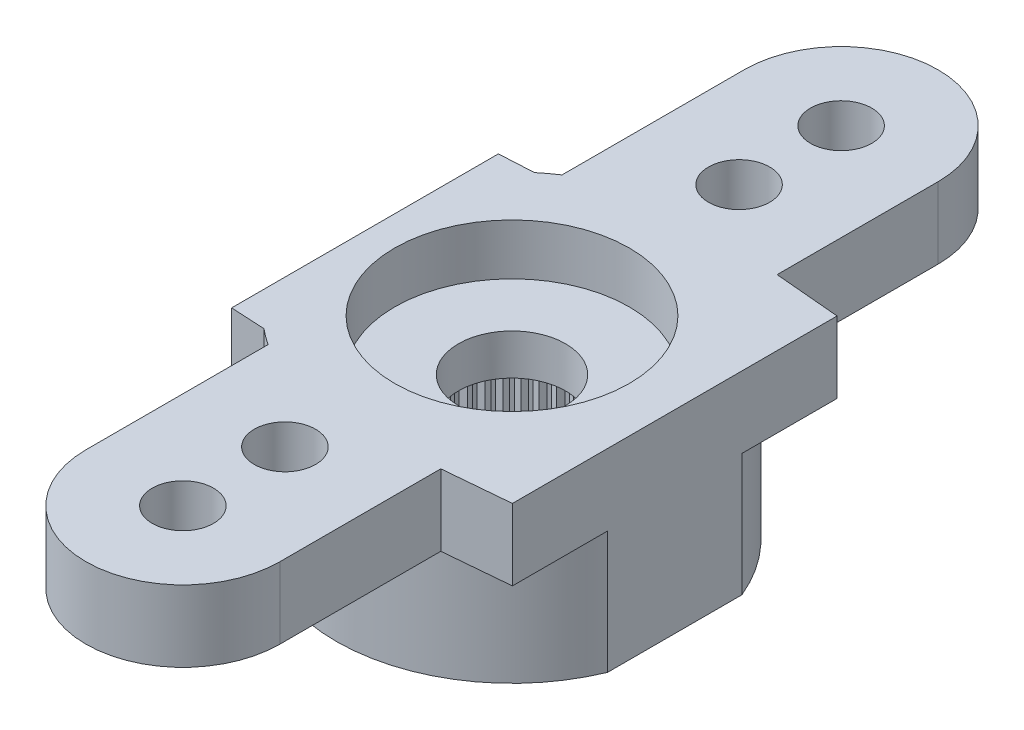
from build123d import *

# Parameters (mm, degrees)
RESSALTO_EXTRUS_O1_DEPTH = 1.4
ESBO_O2_R                = 3.45
RESSALTO_EXTRUS_O2_DEPTH = 2.4
FURO1_D                  = 1.2
PADR_O_LINEAR1_COUNT     = 6
PADR_O_LINEAR1_PITCH     = 2
RESSALTO_EXTRUS_O3_DEPTH = 1.4
FURO2_D                  = 1.2
PADR_O_LINEAR2_COUNT     = 7
PADR_O_LINEAR2_PITCH     = 2
RESSALTO_EXTRUS_O4_DEPTH = 1.4
FURO3_D                  = 1.2
PADR_O_LINEAR3_COUNT     = 2
PADR_O_LINEAR3_PITCH     = 2
PADR_OCIRCULAR1_COUNT    = 2
PADR_OCIRCULAR1_COPY_1_D = 1.2
FURO4_D                  = 4.95
FURO4_DEPTH              = 2
FURO5_D                  = 4.6
FURO5_DEPTH              = 1
FURO6_D                  = 2.1
RESSALTO_EXTRUS_O5_START = -2
RESSALTO_EXTRUS_O5_DEPTH = 2
PADR_OCIRCULAR2_COUNT    = 60
SKETCH4_W                = 15.495114936
SKETCH4_H                = 17.003754514
SKETCH4_W_2              = 16.940618464
SKETCH4_H_2              = 16.09212465
CUT_EXTRUDE1_DEPTH       = 10


with BuildPart() as part:
    # Esboço1 → Ressalto-extrusão1 (new body)
    with BuildSketch(Plane(origin=(0, 0, 0), x_dir=(1, 0, 0), z_dir=(0, 1, 0))):
        with BuildLine():
            Line((-14.159121967, 1.99702088), (-2.209072203, 2.65))
            ThreePointArc((-2.209072203, 2.65), (3.45, 0), (-2.209072203, -2.65))
            Line((-2.209072203, -2.65), (-14.159121967, -1.99702088))
            ThreePointArc((-14.159121967, -1.99702088), (-16.05, 0), (-14.159121967, 1.99702088))
        make_face()
    extrude(amount=-RESSALTO_EXTRUS_O1_DEPTH)

    # Esboço2 → Ressalto-extrusão2 (add)
    with BuildSketch(Plane.XZ.offset(1.4)):
        with Locations(Location((0, 0, 0), (0, 0, 90))):
            Circle(ESBO_O2_R)
    extrude(amount=RESSALTO_EXTRUS_O2_DEPTH)

    # Furo1 (through all)
    with Locations(Plane(origin=(0, 0, 0), x_dir=(1, 0, 0), z_dir=(0, 1, 0))):
        with Locations((-14.45, 0)):
            furo1 = Hole(FURO1_D / 2)

    # Padrão linear1: Furo1 ×6
    with Locations(*[(i * PADR_O_LINEAR1_PITCH, 0, 0) for i in range(1, PADR_O_LINEAR1_COUNT)]):
        add(furo1, mode=Mode.SUBTRACT)

    # Esboço12 → Ressalto-extrusão3 (add)
    with BuildSketch(Plane(origin=(0, 0, 0), x_dir=(1, 0, 0), z_dir=(0, 1, 0))):
        with BuildLine():
            Line((0.304103343, 3.436571134), (16.626291793, 1.99221515))
            ThreePointArc((16.626291793, 1.99221515), (18.45, 0), (16.626291793, -1.99221515))
            Line((16.626291793, -1.99221515), (0.304103343, -3.436571134))
            ThreePointArc((0.304103343, -3.436571134), (3.45, 0), (0.304103343, 3.436571134))
        make_face()
    extrude(amount=-RESSALTO_EXTRUS_O3_DEPTH)

    # Furo2 (through all)
    with Locations(Plane(origin=(0, 0, 0), x_dir=(1, 0, 0), z_dir=(0, 1, 0))):
        with Locations((16.85, 0)):
            furo2 = Hole(FURO2_D / 2)

    # Padrão linear2: Furo2 ×7
    with Locations(*[(-i * PADR_O_LINEAR2_PITCH, 0, 0) for i in range(1, PADR_O_LINEAR2_COUNT)]):
        add(furo2, mode=Mode.SUBTRACT)

    # Esboço16 → Ressalto-extrusão4 (add)
    with BuildSketch(Plane(origin=(0, 0, 0), x_dir=(1, 0, 0), z_dir=(0, 1, 0))):
        with BuildLine():
            Line((-1.9, -6.45), (-1.9, 6.45))
            ThreePointArc((-1.9, 6.45), (0, 8.35), (1.9, 6.45))
            Line((1.9, 6.45), (1.9, -6.45))
            ThreePointArc((1.9, -6.45), (0, -8.35), (-1.9, -6.45))
        make_face()
    extrude(amount=-RESSALTO_EXTRUS_O4_DEPTH)

    # Furo3 (through all)
    with Locations(Plane(origin=(0, 0, 0), x_dir=(1, 0, 0), z_dir=(0, 1, 0))):
        with Locations((0, -6.45)):
            furo3 = Hole(FURO3_D / 2)

    # Padrão linear3: Furo3 ×2
    with Locations(*[(0, 0, -i * PADR_O_LINEAR3_PITCH) for i in range(1, PADR_O_LINEAR3_COUNT)]):
        add(furo3, mode=Mode.SUBTRACT)

    # PadrãoCircular1: Furo3 ×2 about axis
    padr_ocircular1_axis = Axis((0, 0, 0), (0, 1, 0))
    for i in range(1, PADR_OCIRCULAR1_COUNT):
        add(furo3.rotate(padr_ocircular1_axis, i * 360 / PADR_OCIRCULAR1_COUNT), mode=Mode.SUBTRACT)

    # PadrãoCircular1 copy 1 (through all)
    with Locations(Plane(origin=(0, 0, 2), x_dir=(-1, 0, 0), z_dir=(0, 1, 0))):
        with Locations((0, -6.45)):
            Hole(PADR_OCIRCULAR1_COPY_1_D / 2)

    # Furo4
    with Locations(Plane(origin=(0, -3.8, 0), x_dir=(-1, 0, 0), z_dir=(0, -1, 0))):
        with Locations((0, 0)):
            Hole(FURO4_D / 2, depth=FURO4_DEPTH)

    # Furo5
    with Locations(Plane(origin=(0, 0, 0), x_dir=(1, 0, 0), z_dir=(0, 1, 0))):
        with Locations((0, 0)):
            Hole(FURO5_D / 2, depth=FURO5_DEPTH)

    # Furo6 (through all)
    with Locations(Plane(origin=(0, 0, 0), x_dir=(1, 0, 0), z_dir=(0, 1, 0))):
        with Locations((0, 0)):
            Hole(FURO6_D / 2)

    # Esboço11 → Ressalto-extrusão5 (add)
    with BuildSketch(Plane.XZ.offset(3.8).offset(RESSALTO_EXTRUS_O5_START)):
        with BuildLine():
            Line((-0.098056786, 2.473056786), (0, 2.375))
            Line((0, 2.375), (0.098056786, 2.473056786))
            ThreePointArc((0.098056786, 2.473056786), (0, 2.475), (-0.098056786, 2.473056786))
        make_face()
    ressalto_extrus_o5 = extrude(amount=RESSALTO_EXTRUS_O5_DEPTH)

    # PadrãoCircular2: Ressalto-extrusão5 ×60 about axis
    padr_ocircular2_axis = Axis((0, 0, 0), (0, 1, 0))
    for i in range(1, PADR_OCIRCULAR2_COUNT):
        add(ressalto_extrus_o5.rotate(padr_ocircular2_axis, i * 360 / PADR_OCIRCULAR2_COUNT))

    # Sketch4 → Cut-Extrude1 (cut)
    with BuildSketch(Plane(origin=(0, 0, 0), x_dir=(1, 0, 0), z_dir=(0, 1, 0))):
        with Locations((-10.628193527, 0.285777387)):
            Rectangle(SKETCH4_W, SKETCH4_H)
        with Locations((11.659584869, 0.741592319)):
            Rectangle(SKETCH4_W_2, SKETCH4_H_2)
    extrude(amount=-CUT_EXTRUDE1_DEPTH, mode=Mode.SUBTRACT)


solid = part.part
